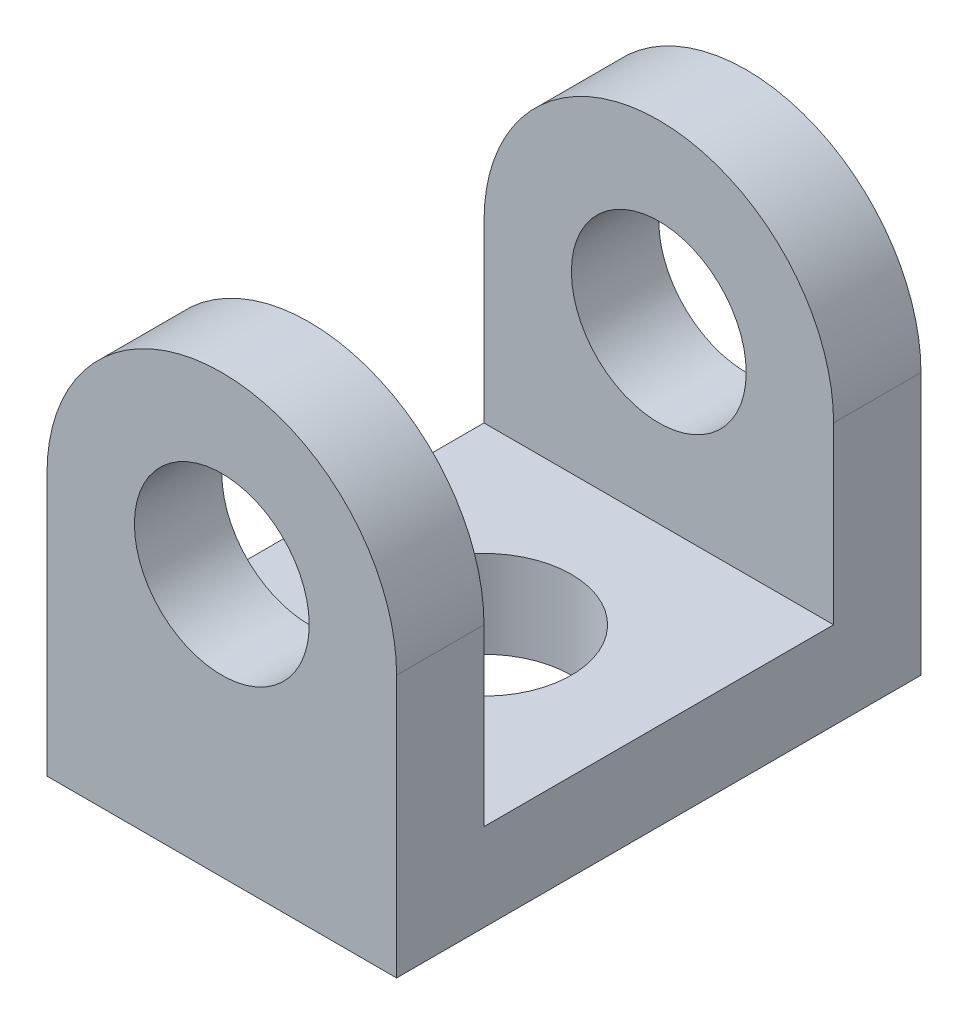
from build123d import *

# Parameters (mm, degrees)
SKETCH1_W           = 40
SKETCH1_H           = 10
BOSS_EXTRUDE1_DEPTH = 30
SKETCH1_3_R         = 10
BOSS_EXTRUDE2_DEPTH = 10
SKETCH3_R           = 10
CUT_EXTRUDE1_DEPTH  = 10


with BuildPart() as part:
    # Sketch1 → Boss-Extrude1 (new body)
    with BuildSketch(Plane.XY):
        with Locations((20, 5)):
            Rectangle(SKETCH1_W, SKETCH1_H)
    boss_extrude1 = extrude(amount=BOSS_EXTRUDE1_DEPTH)

    # Sketch1<3> → Boss-Extrude2 (add)
    with BuildSketch(Plane.XY):
        with BuildLine():
            Line((0, 30), (0, 10))
            Line((0, 10), (40, 10))
            Line((40, 10), (40, 30))
            ThreePointArc((40, 30), (20, 50), (0, 30))
        make_face()
        with Locations((20, 30)):
            Circle(SKETCH1_3_R, mode=Mode.SUBTRACT)
    boss_extrude2 = extrude(amount=BOSS_EXTRUDE2_DEPTH)

    # Mirror2: Boss-Extrude1, Boss-Extrude2 across plane
    add(boss_extrude1.mirror(Plane.XY.offset(30)))
    add(boss_extrude2.mirror(Plane.XY.offset(30)))

    # Sketch3 → Cut-Extrude1 (cut)
    with BuildSketch(Plane(origin=(0, 0, 0), x_dir=(1, 0, 0), z_dir=(0, 1, 0))):
        with Locations((20, -30)):
            Circle(SKETCH3_R)
    extrude(amount=CUT_EXTRUDE1_DEPTH, mode=Mode.SUBTRACT)


solid = part.part
